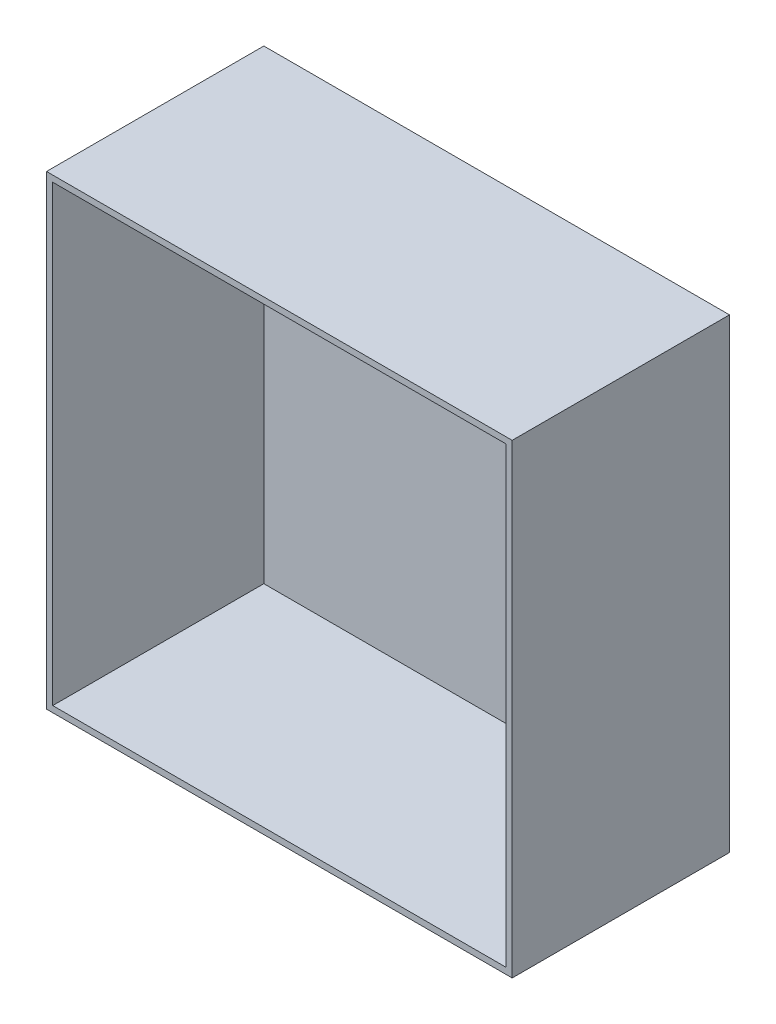
from build123d import *

# Parameters (mm, degrees)
SKIZZE1_W                       = 150
SKIZZE1_H                       = 150
AUFSATZ_LINEAR_AUSTRAGEN1_DEPTH = 70
SKIZZE2_W                       = 146
SKIZZE2_H                       = 146
SCHNITT_LINEAR_AUSTRAGEN1_DEPTH = 68


with BuildPart() as part:
    # Skizze1 → Aufsatz-Linear austragen1 (new body)
    with BuildSketch(Plane.XY):
        with Locations((75, -75)):
            Rectangle(SKIZZE1_W, SKIZZE1_H)
    extrude(amount=AUFSATZ_LINEAR_AUSTRAGEN1_DEPTH)

    # Skizze2 → Schnitt-Linear austragen1 (cut)
    with BuildSketch(Plane.XY.offset(70)):
        with Locations((75, -75)):
            Rectangle(SKIZZE2_W, SKIZZE2_H)
    extrude(amount=-SCHNITT_LINEAR_AUSTRAGEN1_DEPTH, mode=Mode.SUBTRACT)


solid = part.part
